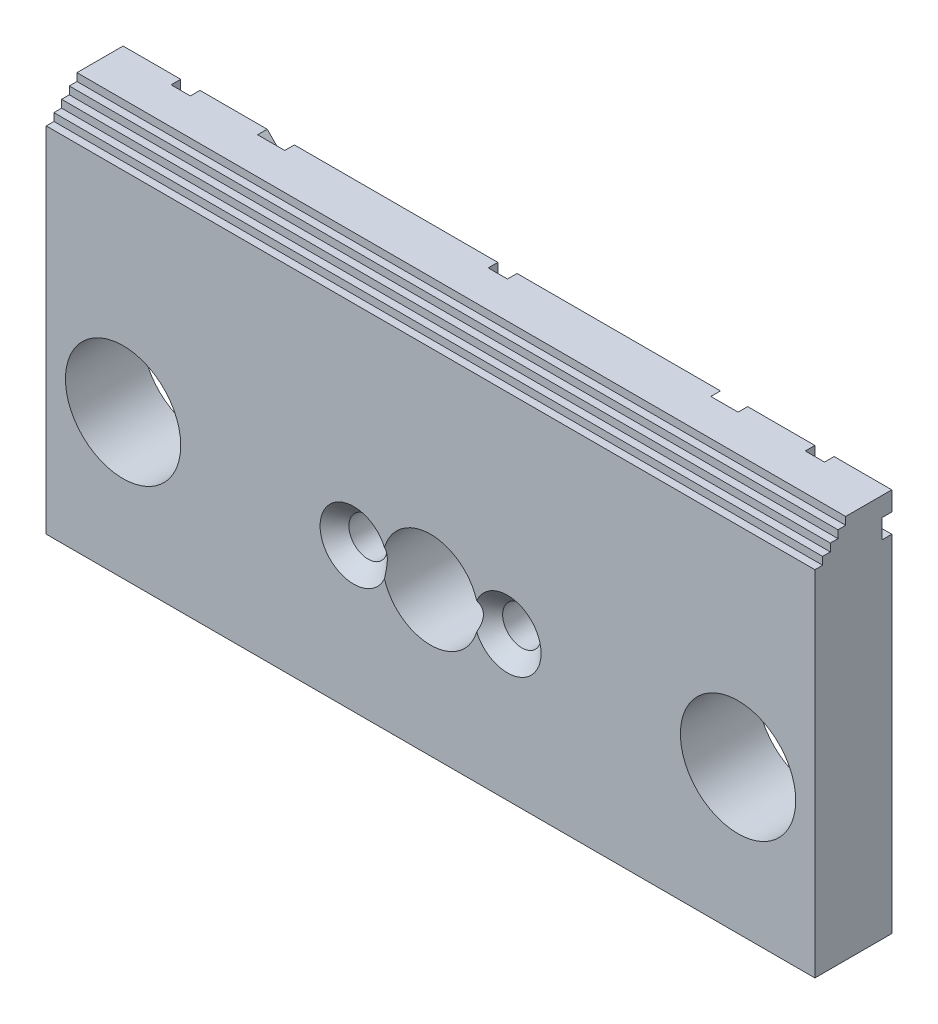
from build123d import *

# Parameters (mm, degrees)
SKETCH_1_W                     = 80
SKETCH_1_H                     = 60
EXTRUDE_1_DEPTH                = 8
HOLE_WIZARD_12_0_12_1_D        = 12
HOLE_WIZARD_10_0_10_2_D        = 10
HOLE_WIZARD_M3_5_1_D           = 4
HOLE_WIZARD_M3_5_1_CSINK_D     = 7
HOLE_WIZARD_M3_5_1_CSINK_ANGLE = 90
CUT_EXTRUDE_1_DEPTH            = 1
CUT_EXTRUDE_2_REACH            = 95.053
CUT_EXTRUDE_3_REACH            = 94.961
SKETCH_29_W                    = 80
SKETCH_29_H                    = 20


with BuildPart() as part:
    # 草图1 → 凸台-拉伸1 (new body)
    with BuildSketch(Plane(origin=(0, 0, 1), x_dir=(-1, 0, 0), z_dir=(0, 0, -1))):
        with Locations((-40, 16.666666667)):
            Rectangle(SKETCH_1_W, SKETCH_1_H)
    extrude(amount=-EXTRUDE_1_DEPTH)

    # Ø12.0 (12) 直径孔1 (through all)
    with Locations(Plane.XY.offset(9)):
        with Locations((72, 21.666666667), (8, 21.666666667)):
            Hole(HOLE_WIZARD_12_0_12_1_D / 2)

    # Ø10.0 (10) 直径孔2 (through all)
    with Locations(Plane(origin=(0, 0, 1), x_dir=(-1, 0, 0), z_dir=(0, 0, -1))):
        with Locations((-40, 21.666666667)):
            Hole(HOLE_WIZARD_10_0_10_2_D / 2)

    # M3.5 平头机械螺钉的锥形沉头孔1 (through all)
    with Locations(Plane.XY.offset(9)):
        with Locations((32, 21.666666667), (48, 21.666666667)):
            CounterSinkHole(HOLE_WIZARD_M3_5_1_D / 2, HOLE_WIZARD_M3_5_1_CSINK_D / 2, counter_sink_angle=HOLE_WIZARD_M3_5_1_CSINK_ANGLE)

    # 草图27 → 切除-拉伸1 (cut)
    with BuildSketch(Plane(origin=(0, 0, 1), x_dir=(-1, 0, 0), z_dir=(0, 0, -1))):
        with BuildLine():
            ThreePointArc((-41, 30.666666667), (-40, 29.666666667), (-39, 30.666666667))
            Line((-39, 30.666666667), (-39, 42.666666667))
            Line((-39, 42.666666667), (-21.828427125, 42.666666667))
            Line((-21.828427125, 42.666666667), (-32.414213562, 32.080880229))
            ThreePointArc((-32.414213562, 32.080880229), (-32.414213562, 30.666666667), (-31, 30.666666667))
            Line((-31, 30.666666667), (-19, 42.666666667))
            Line((-19, 42.666666667), (-8, 42.666666667))
            Line((-8, 42.666666667), (-8, 30.666666667))
            ThreePointArc((-8, 30.666666667), (-7, 29.666666667), (-6, 30.666666667))
            Line((-6, 30.666666667), (-6, 42.666666667))
            Line((-6, 42.666666667), (0, 42.666666667))
            Line((0, 42.666666667), (0, 44.666666667))
            Line((0, 44.666666667), (-6, 44.666666667))
            Line((-6, 44.666666667), (-6, 46.666666667))
            Line((-6, 46.666666667), (-8, 46.666666667))
            Line((-8, 46.666666667), (-8, 44.666666667))
            Line((-8, 44.666666667), (-17, 44.666666667))
            Line((-17, 44.666666667), (-15, 46.666666667))
            Line((-15, 46.666666667), (-16.414213562, 48.080880229))
            Line((-16.414213562, 48.080880229), (-19.828427125, 44.666666667))
            Line((-19.828427125, 44.666666667), (-39, 44.666666667))
            Line((-39, 44.666666667), (-39, 46.666666667))
            Line((-39, 46.666666667), (-41, 46.666666667))
            Line((-41, 46.666666667), (-41, 44.666666667))
            Line((-41, 44.666666667), (-60.171572875, 44.666666667))
            Line((-60.171572875, 44.666666667), (-63.585786438, 48.080880229))
            Line((-63.585786438, 48.080880229), (-65, 46.666666667))
            Line((-65, 46.666666667), (-63, 44.666666667))
            Line((-63, 44.666666667), (-72, 44.666666667))
            Line((-72, 44.666666667), (-72, 46.666666667))
            Line((-72, 46.666666667), (-74, 46.666666667))
            Line((-74, 46.666666667), (-74, 44.666666667))
            Line((-74, 44.666666667), (-80, 44.666666667))
            Line((-80, 44.666666667), (-80, 42.666666667))
            Line((-80, 42.666666667), (-74, 42.666666667))
            Line((-74, 42.666666667), (-74, 30.666666667))
            ThreePointArc((-74, 30.666666667), (-73, 29.666666667), (-72, 30.666666667))
            Line((-72, 30.666666667), (-72, 42.666666667))
            Line((-72, 42.666666667), (-61, 42.666666667))
            Line((-61, 42.666666667), (-49, 30.666666667))
            ThreePointArc((-49, 30.666666667), (-47.585786438, 30.666666667), (-47.585786438, 32.080880229))
            Line((-47.585786438, 32.080880229), (-58.171572875, 42.666666667))
            Line((-58.171572875, 42.666666667), (-41, 42.666666667))
            Line((-41, 42.666666667), (-41, 30.666666667))
        make_face()
    extrude(amount=-CUT_EXTRUDE_1_DEPTH, mode=Mode.SUBTRACT)

    # 草图28 → 切除-拉伸2 (cut, up to next)
    with BuildSketch(Plane.ZY, mode=Mode.PRIVATE) as cut_extrude_2_sk1:
        Polygon((9, 46.666666667), (5.8, 46.666666667), (5.8, 45.866666667), (6.6, 45.866666667), (6.6, 45.066666667), (7.4, 45.066666667), (7.4, 44.266666667), (8.2, 44.266666667), (8.2, 43.466666667), (9, 43.466666667), align=None)
    cut_extrude_2_tool1 = extrude(cut_extrude_2_sk1.sketch, amount=-CUT_EXTRUDE_2_REACH, mode=Mode.PRIVATE) & part.part
    add(cut_extrude_2_tool1.solids().sort_by_distance((0, 45.466667, 7.8))[0], mode=Mode.SUBTRACT)

    # 草图29 → 切除-拉伸3 (cut, up to next)
    with BuildSketch(Plane(origin=(0, 0, 1), x_dir=(-1, 0, 0), z_dir=(0, 0, -1)), mode=Mode.PRIVATE) as cut_extrude_3_sk1:
        with Locations((-40, -3.333333333)):
            Rectangle(SKETCH_29_W, SKETCH_29_H)
    cut_extrude_3_tool1 = extrude(cut_extrude_3_sk1.sketch, amount=-CUT_EXTRUDE_3_REACH, mode=Mode.PRIVATE) & part.part
    add(cut_extrude_3_tool1.solids().sort_by_distance((40, -3.333333, 1))[0], mode=Mode.SUBTRACT)


solid = part.part
